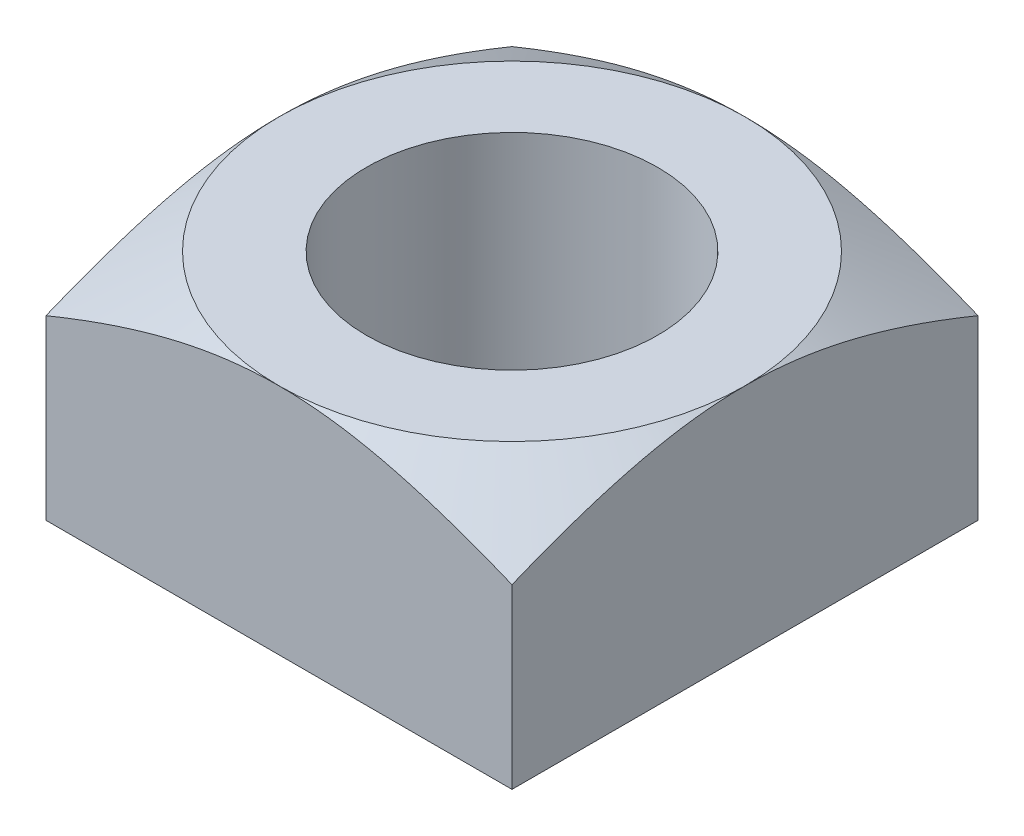
from build123d import *

# Parameters (mm, degrees)
SKETCH1_W           = 8
SKETCH1_H           = 8
SKETCH1_R           = 2.5
BOSS_EXTRUDE1_DEPTH = 2
SKETCH5_OUTSIDE_W   = 39.864
SKETCH5_OUTSIDE_H   = 39.864
SKETCH5_OUTSIDE_R   = 4
CUT_EXTRUDE2_DEPTH  = 7.92820323
CUT_EXTRUDE2_DRAFT  = -60


with BuildPart() as part:
    # Sketch1 → Boss-Extrude1 (new, symmetric)
    with BuildSketch(Plane(origin=(0, 0, 0), x_dir=(1, 0, 0), z_dir=(0, 1, 0))):
        Rectangle(SKETCH1_W, SKETCH1_H)
        Circle(SKETCH1_R, mode=Mode.SUBTRACT)
    extrude(amount=BOSS_EXTRUDE1_DEPTH, both=True)


with BuildPart() as cut_extrude2_tool:
    # Sketch5 outside → Cut-Extrude2 (with draft: the straight prism first)
    with BuildSketch(Plane(origin=(0, 2, 0), x_dir=(1, 0, 0), z_dir=(0, 1, 0))):
        Rectangle(SKETCH5_OUTSIDE_W, SKETCH5_OUTSIDE_H)
        Circle(SKETCH5_OUTSIDE_R, mode=Mode.SUBTRACT)
    extrude(amount=-CUT_EXTRUDE2_DEPTH)
    # Cut-Extrude2: the draft: its side faces are tilted about the plane it starts from
    cut_extrude2_sides = [cut_extrude2_tool.faces().sort_by_distance(p)[0] for p in [
        (0, -1.964101615, 19.932),
        (19.932, -1.964101615, 0),
        (0, -1.964101615, -19.932),
        (-19.932, -1.964101615, 0),
        (-4, -1.964101615, 0),
    ]]
    draft(cut_extrude2_sides, Plane(origin=(0, 2, 0), x_dir=(1, 0, 0), z_dir=(0, 1, 0)), CUT_EXTRUDE2_DRAFT)


with BuildPart() as part_1:
    add(part.part)

    # Cut-Extrude2: cut by cut_extrude2_tool
    add(cut_extrude2_tool.part, mode=Mode.SUBTRACT)


solid = part_1.part
